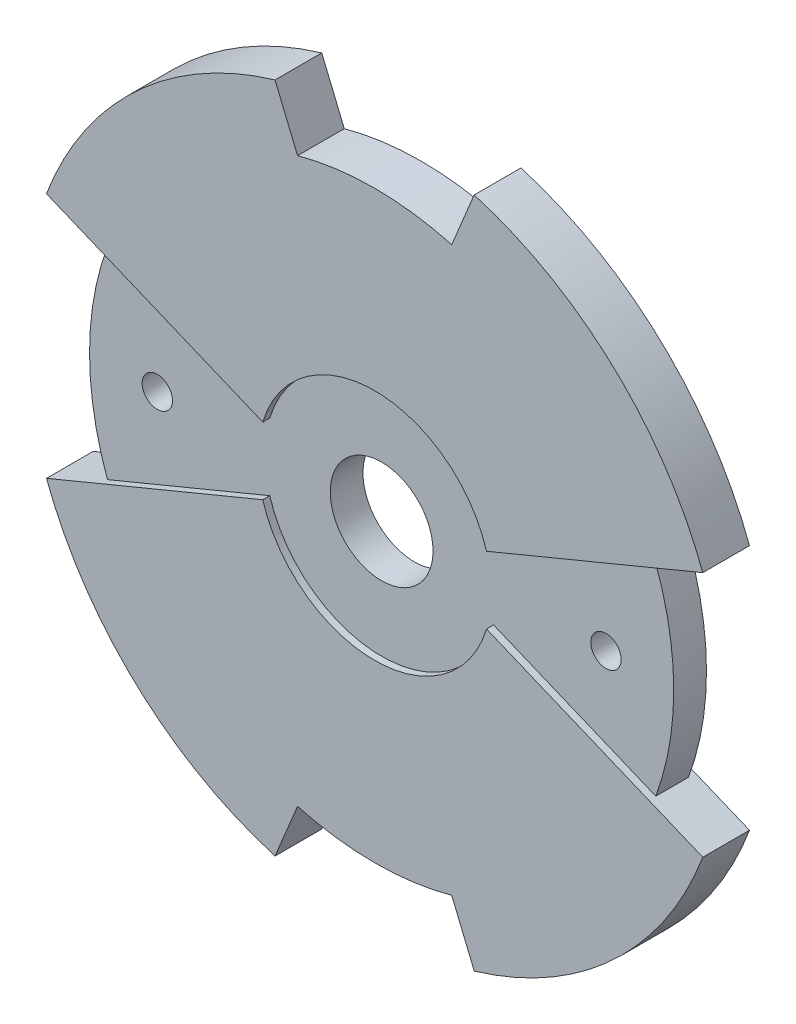
from build123d import *

# Parameters (mm, degrees)
BOSS_EXTRUDE4_DEPTH   = 5
BOSS_EXTRUDE4_2_DEPTH = 5
BOSS_EXTRUDE5_DEPTH   = 3.5
SKETCH2_R             = 11
CUT_EXTRUDE3_DEPTH    = 10
SKETCH2_4_R           = 11
SKETCH2_4_R_2         = 3.25
CUT_EXTRUDE4_DEPTH    = 25


with BuildPart() as part:
    # Sketch1 → Boss-Extrude4 (new, symmetric)
    with BuildSketch(Plane.XY):
        with BuildLine():
            ThreePointArc((-23.941610741, 7.197171327), (0, 25), (23.941610741, 7.197171327))
            Line((23.941610741, 7.197171327), (70.213649137, 26.363677189))
            ThreePointArc((70.213649137, 26.363677189), (51.115143098, 54.883896965), (21.3105738, 71.908688239))
            Line((21.3105738, 71.908688239), (16.495435726, 60.283916597))
            ThreePointArc((16.495435726, 60.283916597), (0, 62.5), (-16.495435726, 60.283916597))
            Line((-16.495435726, 60.283916597), (-21.3105738, 71.908688239))
            ThreePointArc((-21.3105738, 71.908688239), (-51.115143098, 54.883896965), (-70.213649137, 26.363677189))
            Line((-70.213649137, 26.363677189), (-23.941610741, 7.197171327))
        make_face()
    extrude(amount=BOSS_EXTRUDE4_DEPTH, both=True)



with BuildPart() as body_2:
    # Sketch1 → Boss-Extrude4 2 (new, symmetric)
    with BuildSketch(Plane.XY):
        with BuildLine():
            ThreePointArc((-16.495435726, -60.283916597), (0, -62.5), (16.495435726, -60.283916597))
            Line((16.495435726, -60.283916597), (21.3105738, -71.908688239))
            ThreePointArc((21.3105738, -71.908688239), (51.115143098, -54.883896965), (70.213649137, -26.363677189))
            Line((70.213649137, -26.363677189), (23.941610741, -7.197171327))
            ThreePointArc((23.941610741, -7.197171327), (0, -25), (-23.941610741, -7.197171327))
            Line((-23.941610741, -7.197171327), (-70.213649137, -26.363677189))
            ThreePointArc((-70.213649137, -26.363677189), (-51.115143098, -54.883896965), (-21.3105738, -71.908688239))
            Line((-21.3105738, -71.908688239), (-16.495435726, -60.283916597))
        make_face()
    extrude(amount=BOSS_EXTRUDE4_2_DEPTH, both=True)


with BuildPart() as part_1:
    add(part.part)

    add(body_2.part)  # Boss-Extrude5 merges body 2
    # Sketch1<3> → Boss-Extrude5 (add, symmetric)
    with BuildSketch(Plane.XY):
        with BuildLine():
            Line((58.657369372, 21.57690938), (23.941610741, 7.197171327))
            ThreePointArc((23.941610741, 7.197171327), (0, 25), (-23.941610741, 7.197171327))
            Line((-23.941610741, 7.197171327), (-58.657369372, 21.57690938))
            ThreePointArc((-58.657369372, 21.57690938), (-62.5, 0), (-58.657369372, -21.57690938))
            Line((-58.657369372, -21.57690938), (-23.941610741, -7.197171327))
            ThreePointArc((-23.941610741, -7.197171327), (0, -25), (23.941610741, -7.197171327))
            Line((23.941610741, -7.197171327), (58.657369372, -21.57690938))
            ThreePointArc((58.657369372, -21.57690938), (61.53184373, -10.958202733), (62.5, 0))
            ThreePointArc((62.5, 0), (61.53184373, 10.958202733), (58.657369372, 21.57690938))
        make_face()
    extrude(amount=BOSS_EXTRUDE5_DEPTH, both=True)

    # Sketch2 → Cut-Extrude3 (cut)
    with BuildSketch(Plane.XY.offset(3.5)):
        Circle(SKETCH2_R)
    extrude(amount=-CUT_EXTRUDE3_DEPTH, mode=Mode.SUBTRACT)

    # Sketch2<4> → Cut-Extrude4 (cut)
    with BuildSketch(Plane.XY.offset(3.5)):
        Circle(SKETCH2_4_R)
        with Locations((48, 0)):
            Circle(SKETCH2_4_R_2)
        with Locations((41.569219382, -24)):
            Circle(SKETCH2_4_R_2)
        with Locations((24, -41.569219382)):
            Circle(SKETCH2_4_R_2)
        with Locations((0, -48)):
            Circle(SKETCH2_4_R_2)
        with Locations((-24, -41.569219382)):
            Circle(SKETCH2_4_R_2)
        with Locations((-41.569219382, -24)):
            Circle(SKETCH2_4_R_2)
        with Locations((-48, 0)):
            Circle(SKETCH2_4_R_2)
        with Locations((-41.569219382, 24)):
            Circle(SKETCH2_4_R_2)
        with Locations((-24, 41.569219382)):
            Circle(SKETCH2_4_R_2)
        with Locations((0, 48)):
            Circle(SKETCH2_4_R_2)
        with Locations((24, 41.569219382)):
            Circle(SKETCH2_4_R_2)
        with Locations((41.569219382, 24)):
            Circle(SKETCH2_4_R_2)
    extrude(amount=-CUT_EXTRUDE4_DEPTH, mode=Mode.SUBTRACT)


solid = part_1.part
